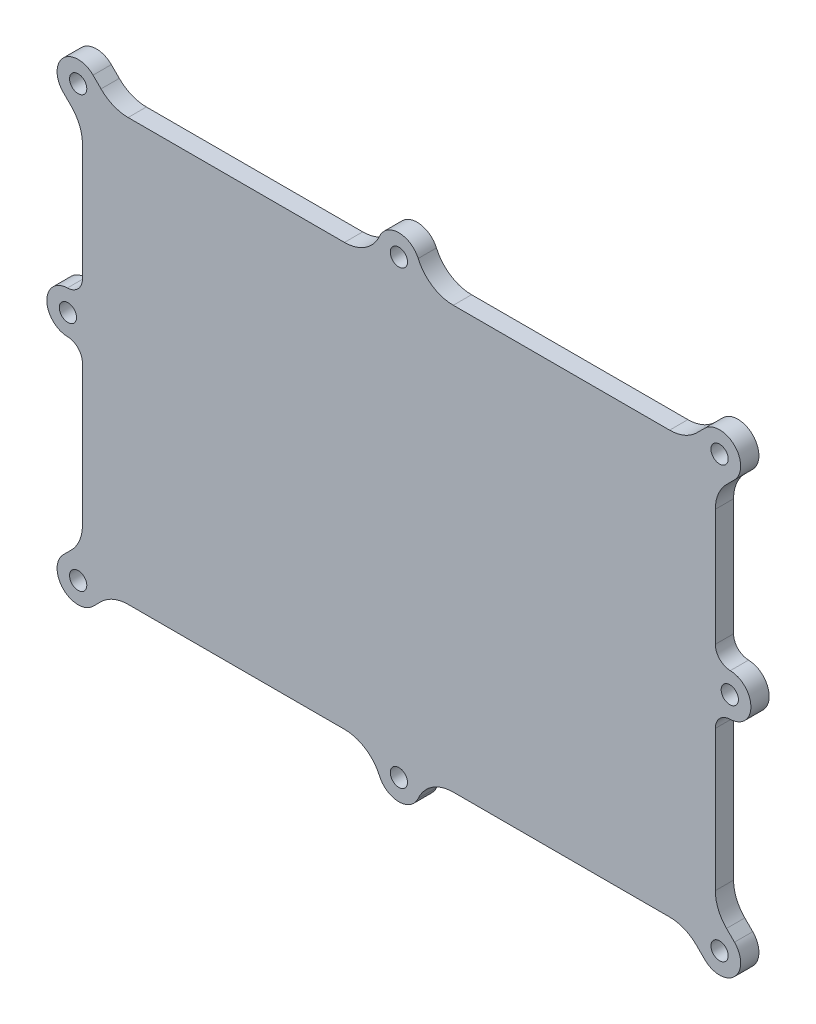
from build123d import *

# Parameters (mm, degrees)
BOSS_EXTRUDE1_DEPTH  = 4.7625
M4_CLEARANCE_HOLE1_D = 4.5


with BuildPart() as part:
    # Sketch2 → Boss-Extrude1 (new body)
    with BuildSketch(Plane.XY):
        with BuildLine():
            Line((183.553261784, 104.332754576), (181.480626284, 102.260119075))
            ThreePointArc((181.480626284, 102.260119075), (178.236392795, 100.092391562), (174.409558472, 99.331186887))
            Line((174.409558472, 99.331186887), (117.978290457, 99.331186887))
            ThreePointArc((117.978290457, 99.331186887), (112.506161662, 100.961252213), (108.818018348, 105.320025597))
            ThreePointArc((108.818018348, 105.320025597), (103.779868689, 108.613886887), (98.741719029, 105.320025597))
            ThreePointArc((98.741719029, 105.320025597), (95.053575715, 100.961252213), (89.58144692, 99.331186887))
            Line((89.58144692, 99.331186887), (33.150178905, 99.331186887))
            ThreePointArc((33.150178905, 99.331186887), (29.323344582, 100.092391562), (26.079111093, 102.260119075))
            Line((26.079111093, 102.260119075), (24.006475593, 104.332754576))
            ThreePointArc((24.006475593, 104.332754576), (16.228301, 104.332754576), (16.228301, 96.554579982))
            Line((16.228301, 96.554579982), (18.3009365, 94.481944482))
            ThreePointArc((18.3009365, 94.481944482), (20.468664014, 91.237710994), (21.229868689, 87.41087667))
            Line((21.229868689, 87.41087667), (21.229868689, 56.908391119))
            ThreePointArc((21.229868689, 56.908391119), (20.090461192, 54.112499396), (17.321363425, 52.909437667))
            ThreePointArc((17.321363425, 52.909437667), (11.947168689, 47.41087667), (17.321363425, 41.912315673))
            ThreePointArc((17.321363425, 41.912315673), (20.090461192, 40.709253944), (21.229868689, 37.913362221))
            Line((21.229868689, 37.913362221), (21.229868689, 1.251497104))
            ThreePointArc((21.229868689, 1.251497104), (20.468664014, -2.57533722), (18.3009365, -5.819570708))
            Line((18.3009365, -5.819570708), (16.228301, -7.892206209))
            ThreePointArc((16.228301, -7.892206209), (16.228301, -15.670380802), (24.006475593, -15.670380802))
            Line((24.006475593, -15.670380802), (26.079111093, -13.597745301))
            ThreePointArc((26.079111093, -13.597745301), (29.323344582, -11.430017788), (33.150178905, -10.668813113))
            Line((33.150178905, -10.668813113), (89.58144692, -10.668813113))
            ThreePointArc((89.58144692, -10.668813113), (95.053575715, -12.298878439), (98.741719029, -16.657651823))
            ThreePointArc((98.741719029, -16.657651823), (103.779868689, -19.951513113), (108.818018348, -16.657651823))
            ThreePointArc((108.818018348, -16.657651823), (112.506161662, -12.298878439), (117.978290457, -10.668813113))
            Line((117.978290457, -10.668813113), (174.409558472, -10.668813113))
            ThreePointArc((174.409558472, -10.668813113), (178.236392795, -11.430017788), (181.480626284, -13.597745301))
            Line((181.480626284, -13.597745301), (183.553261784, -15.670380802))
            ThreePointArc((183.553261784, -15.670380802), (191.331436377, -15.670380802), (191.331436377, -7.892206209))
            Line((191.331436377, -7.892206209), (189.258800877, -5.819570708))
            ThreePointArc((189.258800877, -5.819570708), (187.091073363, -2.57533722), (186.329868689, 1.251497104))
            Line((186.329868689, 1.251497104), (186.329868689, 37.913362221))
            ThreePointArc((186.329868689, 37.913362221), (187.469276185, 40.709253944), (190.238373952, 41.912315673))
            ThreePointArc((190.238373952, 41.912315673), (195.612568689, 47.41087667), (190.238373952, 52.909437667))
            ThreePointArc((190.238373952, 52.909437667), (187.469276185, 54.112499396), (186.329868689, 56.908391119))
            Line((186.329868689, 56.908391119), (186.329868689, 87.41087667))
            ThreePointArc((186.329868689, 87.41087667), (187.091073363, 91.237710994), (189.258800877, 94.481944482))
            Line((189.258800877, 94.481944482), (191.331436377, 96.554579982))
            ThreePointArc((191.331436377, 96.554579982), (191.331436377, 104.332754576), (183.553261784, 104.332754576))
        make_face()
    extrude(amount=BOSS_EXTRUDE1_DEPTH)

    # M4 Clearance Hole1 (through all)
    with Locations(Plane.XY.offset(4.7625)):
        with Locations((17.447168689, 47.41087667), (20.117388296, 100.443667279), (103.779868689, 103.113886887), (187.442349081, 100.443667279), (190.112568689, 47.41087667), (187.442349081, -11.781293505), (103.779868689, -14.451513113), (20.117388296, -11.781293505)):
            Hole(M4_CLEARANCE_HOLE1_D / 2)


solid = part.part
